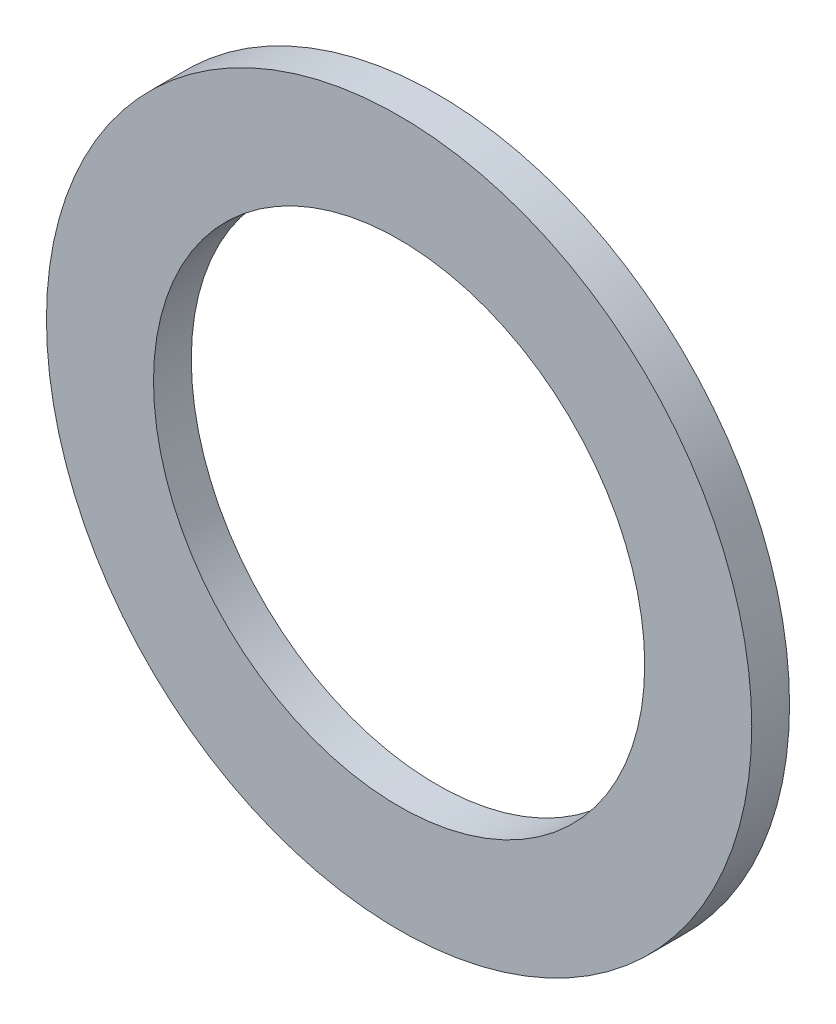
from build123d import *

# Parameters (mm, degrees)
SKETCH_1_R      = 14
SKETCH_1_R_2    = 9.75
EXTRUDE_1_DEPTH = 1.5


with BuildPart() as part:
    # Эскиз1 → Вытянуть1 (new body)
    with BuildSketch(Plane.XY):
        Circle(SKETCH_1_R)
        Circle(SKETCH_1_R_2, mode=Mode.SUBTRACT)
    extrude(amount=EXTRUDE_1_DEPTH)


solid = part.part
